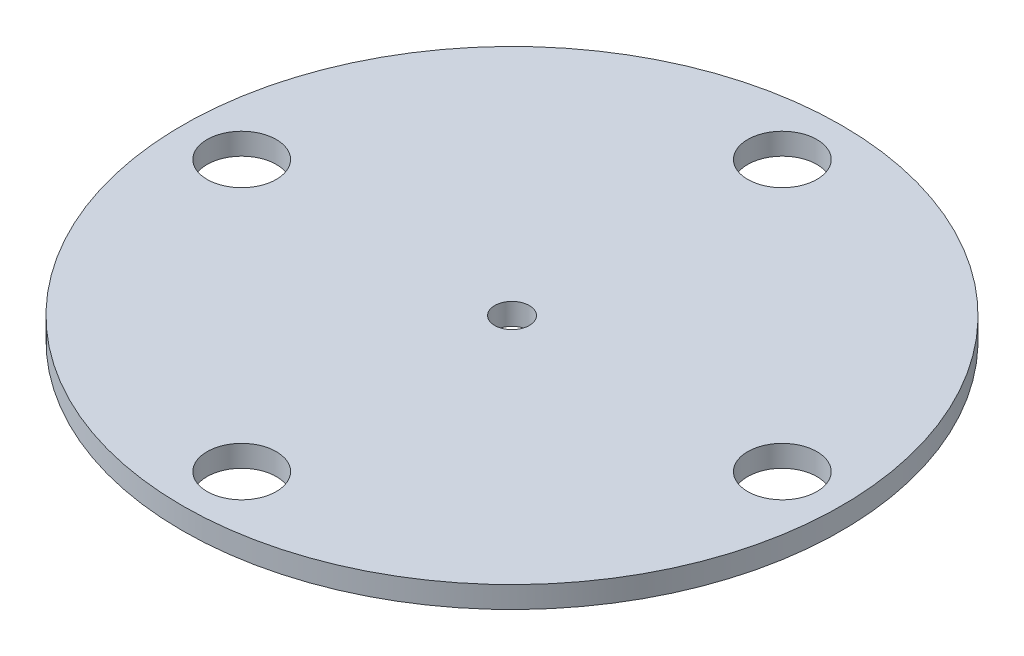
from build123d import *

# Parameters (mm, degrees)
SKETCH1_R           = 76.2
SKETCH1_R_2         = 4
BOSS_EXTRUDE2_DEPTH = 5
SKETCH2_R           = 8
CUT_EXTRUDE1_DEPTH  = 108.879006299


with BuildPart() as part:
    # Sketch1 → Boss-Extrude2 (new body)
    with BuildSketch(Plane(origin=(0, 0, 0), x_dir=(1, 0, 0), z_dir=(0, 1, 0))):
        with Locations(Location((0, 0, 0), (0, 0, 270))):
            Circle(SKETCH1_R)
        with Locations(Location((0, 0, 0), (0, 0, 270))):
            Circle(SKETCH1_R_2, mode=Mode.SUBTRACT)
    extrude(amount=BOSS_EXTRUDE2_DEPTH)

    # Sketch2 → Cut-Extrude1 (cut, through all)
    with BuildSketch(Plane(origin=(0, 5, 0), x_dir=(1, 0, 0), z_dir=(0, 1, 0))):
        with Locations(Location((0, -62.5, 0), (0, 0, 270))):
            Circle(SKETCH2_R)
        with Locations(Location((-62.5, 0, 0), (0, 0, 270))):
            Circle(SKETCH2_R)
        with Locations(Location((0, 62.5, 0), (0, 0, 270))):
            Circle(SKETCH2_R)
        with Locations(Location((62.5, 0, 0), (0, 0, 270))):
            Circle(SKETCH2_R)
    extrude(amount=-CUT_EXTRUDE1_DEPTH, mode=Mode.SUBTRACT)


solid = part.part
